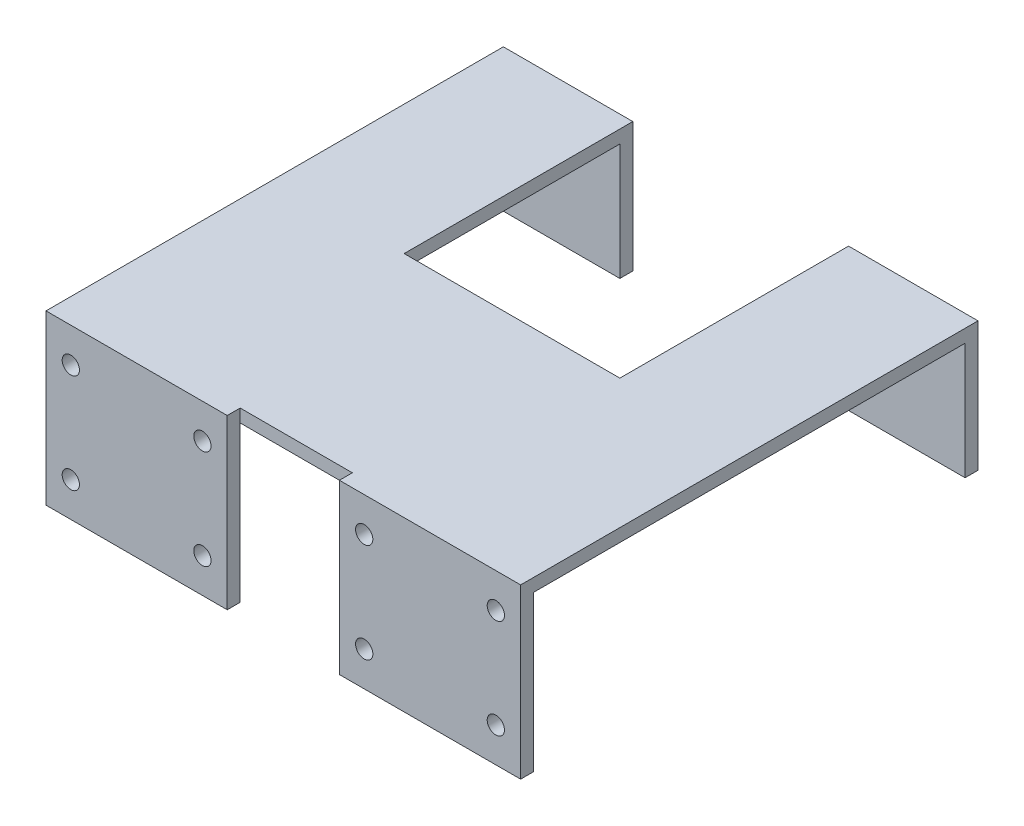
from build123d import *

# Parameters (mm, degrees)
BOSS_EXTRUDE1_DEPTH = 3
SKETCH4_W           = 42
SKETCH4_H           = 39
SKETCH4_R           = 2
BOSS_EXTRUDE2_DEPTH = 3
SKETCH5_W           = 30
SKETCH5_H           = 30
SKETCH5_R           = 2
BOSS_EXTRUDE3_DEPTH = 3


with BuildPart() as part:
    # Sketch2 → Boss-Extrude1 (new body)
    with BuildSketch(Plane(origin=(0, 0, 0), x_dir=(1, 0, 0), z_dir=(0, 1, 0))):
        Polygon((-55, 52.280903811), (-55, -47.719096189), (55, -47.719096189), (55, 52.280903811), (25, 52.280903811), (25, 2.280903811), (-25, 2.280903811), (-25, 52.280903811), align=None)
    extrude(amount=BOSS_EXTRUDE1_DEPTH)

    # Sketch4 → Boss-Extrude2 (add)
    # profile 1 of 2: a face of its own
    with BuildSketch(Plane.XY.offset(47.719096189)):
        with Locations((-34, -16.5)):
            Rectangle(SKETCH4_W, SKETCH4_H)
        with Locations((-18.75, -5)):
            Circle(SKETCH4_R, mode=Mode.SUBTRACT)
        with Locations(Location((-49.25, -5, 0), (0, 0, 180))):
            Circle(SKETCH4_R, mode=Mode.SUBTRACT)
        with Locations(Location((-18.75, -28, 0), (0, 0, 180))):
            Circle(SKETCH4_R, mode=Mode.SUBTRACT)
        with Locations((-49.25, -28)):
            Circle(SKETCH4_R, mode=Mode.SUBTRACT)
    # profile 2 of 2: a face of its own
    with BuildSketch(Plane.XY.offset(47.719096189)):
        with Locations((34, -16.5)):
            Rectangle(SKETCH4_W, SKETCH4_H)
        with Locations((49.25, -5)):
            Circle(SKETCH4_R, mode=Mode.SUBTRACT)
        with Locations(Location((49.25, -28, 0), (0, 0, 180))):
            Circle(SKETCH4_R, mode=Mode.SUBTRACT)
        with Locations(Location((18.75, -5, 0), (0, 0, 180))):
            Circle(SKETCH4_R, mode=Mode.SUBTRACT)
        with Locations((18.75, -28)):
            Circle(SKETCH4_R, mode=Mode.SUBTRACT)
    extrude(amount=BOSS_EXTRUDE2_DEPTH)

    # Sketch5 → Boss-Extrude3 (add)
    # profile 1 of 2: a face of its own
    with BuildSketch(Plane(origin=(0, 0, -52.280903811), x_dir=(-1, 0, 0), z_dir=(0, 0, -1))):
        with Locations((40, -12)):
            Rectangle(SKETCH5_W, SKETCH5_H)
        with Locations((40, -12)):
            Circle(SKETCH5_R, mode=Mode.SUBTRACT)
    # profile 2 of 2: a face of its own
    with BuildSketch(Plane(origin=(0, 0, -52.280903811), x_dir=(-1, 0, 0), z_dir=(0, 0, -1))):
        with Locations((-40, -12)):
            Rectangle(SKETCH5_W, SKETCH5_H)
        with Locations(Location((-40, -12, 0), (0, 0, 180))):
            Circle(SKETCH5_R, mode=Mode.SUBTRACT)
    extrude(amount=BOSS_EXTRUDE3_DEPTH)


solid = part.part
